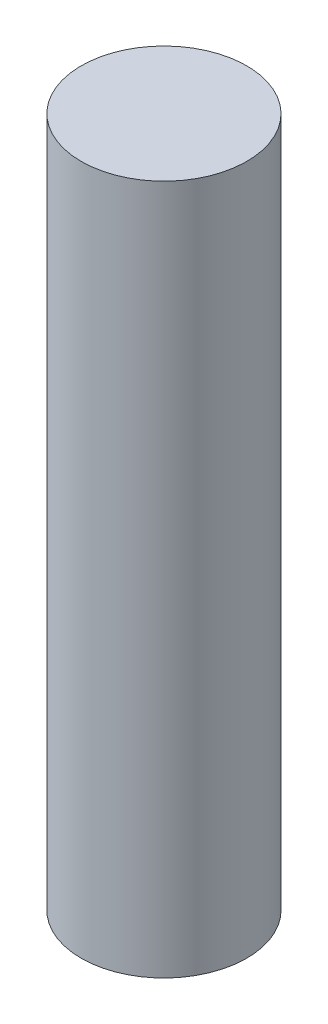
from build123d import *

# Parameters (mm, degrees)
SKETCH1_R           = 2.4
BOSS_EXTRUDE1_DEPTH = 20


with BuildPart() as part:
    # Sketch1 → Boss-Extrude1 (new body)
    with BuildSketch(Plane(origin=(0, 0, 0), x_dir=(1, 0, 0), z_dir=(0, 1, 0))):
        with Locations(Location((0, 0, 0), (0, 0, 270))):
            Circle(SKETCH1_R)
    extrude(amount=BOSS_EXTRUDE1_DEPTH)


solid = part.part
